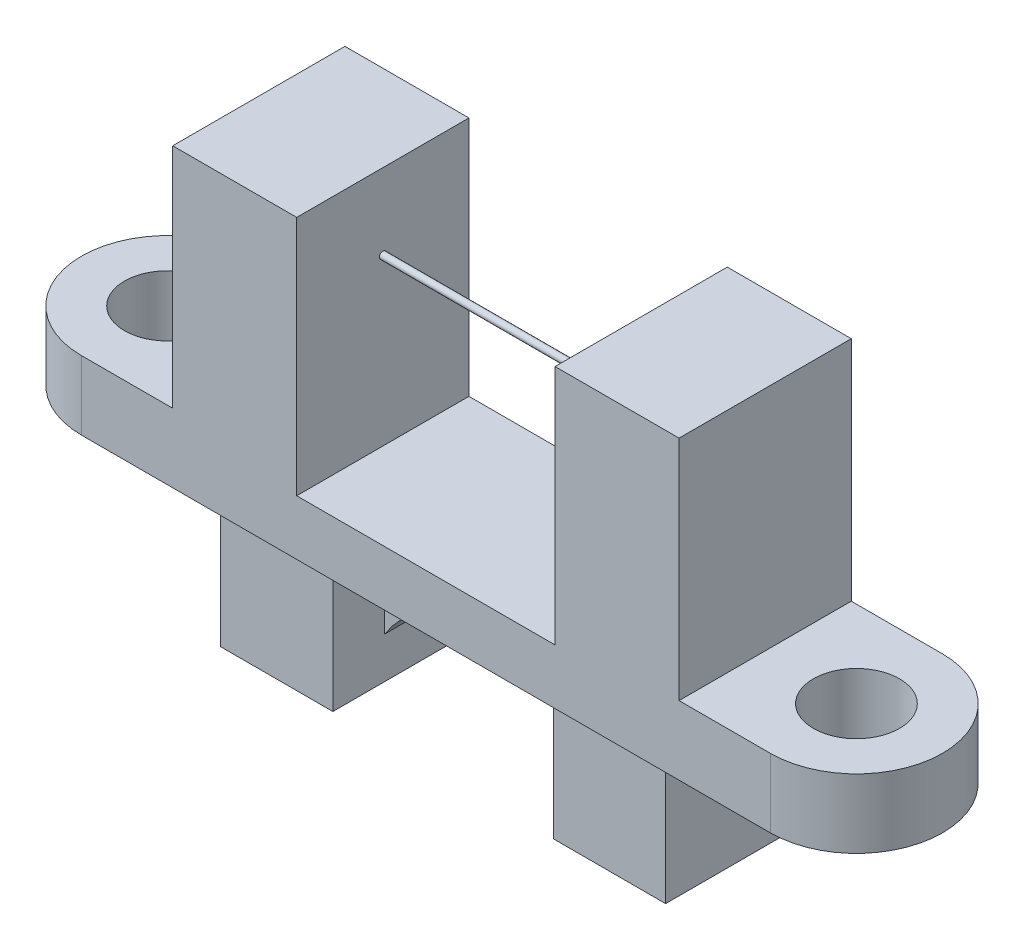
from build123d import *

# Parameters (mm, degrees)
BASE_EXTRUDE_DEPTH  = 2.54
SKETCH2_W           = 9.525
SKETCH2_H           = 6.35
CUT_EXTRUDE1_DEPTH  = 0.508
SKETCH3_W           = 4.572
SKETCH3_H           = 6.35
BOSS_EXTRUDE1_DEPTH = 8.382
SKETCH4_R           = 1.5875
CUT_EXTRUDE2_DEPTH  = 19.230583479
SKETCH5_W           = 4.1402
SKETCH5_H           = 5.08
BOSS_EXTRUDE2_DEPTH = 4.826
BOSS_EXTRUDE3_DEPTH = 0.635
SKETCH7_R           = 0.127
BOSS_EXTRUDE4_DEPTH = 9.525


with BuildPart() as part:
    # Sketch1 → Base-Extrude (new body)
    with BuildSketch(Plane(origin=(0, 0, 0), x_dir=(1, 0, 0), z_dir=(0, 1, 0))):
        with BuildLine():
            Line((12.7, 3.175), (-12.7, 3.175))
            ThreePointArc((-12.7, 3.175), (-15.875, 0), (-12.7, -3.175))
            Line((-12.7, -3.175), (12.7, -3.175))
            ThreePointArc((12.7, -3.175), (15.875, 0), (12.7, 3.175))
        make_face()
    extrude(amount=BASE_EXTRUDE_DEPTH)

    # Sketch2 → Cut-Extrude1 (cut)
    with BuildSketch(Plane(origin=(0, 2.54, 0), x_dir=(-1, 0, 0), z_dir=(0, 1, 0))):
        Rectangle(SKETCH2_W, SKETCH2_H)
    extrude(amount=-CUT_EXTRUDE1_DEPTH, mode=Mode.SUBTRACT)

    # Sketch3 → Boss-Extrude1 (add)
    with BuildSketch(Plane(origin=(0, 2.54, 0), x_dir=(-1, 0, 0), z_dir=(0, 1, 0))):
        with Locations((-7.0485, 0)):
            Rectangle(SKETCH3_W, SKETCH3_H)
        with Locations((7.0485, 0)):
            Rectangle(SKETCH3_W, SKETCH3_H)
    extrude(amount=BOSS_EXTRUDE1_DEPTH)

    # Sketch4 → Cut-Extrude2 (cut, through all)
    with BuildSketch(Plane(origin=(0, 2.54, 0), x_dir=(-1, 0, 0), z_dir=(0, 1, 0))):
        with Locations(Location((-12.7, 0, 0), (0, 0, 90))):
            Circle(SKETCH4_R)
        with Locations(Location((12.7, 0, 0), (0, 0, 270))):
            Circle(SKETCH4_R)
    extrude(amount=-CUT_EXTRUDE2_DEPTH, mode=Mode.SUBTRACT)

    # Sketch5 → Boss-Extrude2 (add)
    with BuildSketch(Plane.XZ):
        with Locations((6.1341, 0)):
            Rectangle(SKETCH5_W, SKETCH5_H)
        with Locations((-6.1341, 0)):
            Rectangle(SKETCH5_W, SKETCH5_H)
    extrude(amount=BOSS_EXTRUDE2_DEPTH)

    # Sketch6 → Boss-Extrude3 (add, symmetric)
    with BuildSketch(Plane.XY):
        with BuildLine():
            Line((-4.064, 0), (4.064, 0))
            Line((4.064, 0), (4.064, -3.305361967))
            ThreePointArc((4.064, -3.305361967), (0, -1.082087461), (-4.064, -3.305361967))
            Line((-4.064, -3.305361967), (-4.064, 0))
        make_face()
    extrude(amount=BOSS_EXTRUDE3_DEPTH, both=True)

    # Sketch7 → Boss-Extrude4 (add)
    with BuildSketch(Plane.ZY.offset(-4.7625)):
        with Locations(Location((0, 8.128, 0), (0, 0, 180))):
            Circle(SKETCH7_R)
    extrude(amount=BOSS_EXTRUDE4_DEPTH)


solid = part.part
